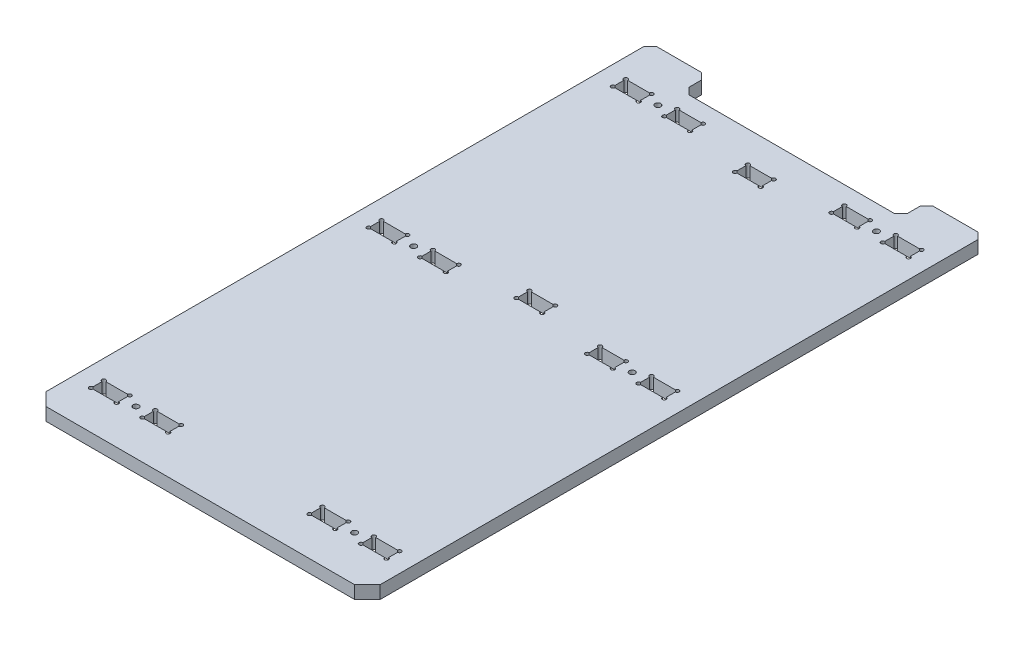
from build123d import *

# Parameters (mm, degrees)
SKETCH1_W            = 260
SKETCH1_H            = 440
EXTRUDE1_DEPTH       = 10
SKETCH3_W            = 260
SKETCH3_H            = 40
EXTRUDE3_DEPTH       = 10
SKETCH4_W            = 20
SKETCH4_H            = 10
CUT_EXTRUDE1_DEPTH   = 10
EXTRUDE4_DEPTH       = 10
MIRROR2_COPY_1_DEPTH = 10
MIRROR3_COPY_1_DEPTH = 10
MIRROR3_COPY_2_DEPTH = 10
MIRROR3_COPY_3_DEPTH = 10
MIRROR4_COPY_1_DEPTH = 10
MIRROR4_COPY_2_DEPTH = 10
MIRROR4_COPY_3_DEPTH = 10
M4_CLEARANCE_HOLE1_D = 4.5
SKETCH8_W            = 20
SKETCH8_H            = 10
CUT_EXTRUDE2_DEPTH   = 10
EXTRUDE5_DEPTH       = 10
CHAMFER1_SIZE        = 10
SKETCH10_W           = 170
SKETCH10_H           = 20
EXTRUDE6_DEPTH       = 10
CHAMFER2_SIZE        = 5


with BuildPart() as part:
    # Sketch1 → Extrude1 (new body)
    with BuildSketch(Plane(origin=(0, 0, 0), x_dir=(1, 0, 0), z_dir=(0, 1, 0))):
        Rectangle(SKETCH1_W, SKETCH1_H)
    extrude(amount=EXTRUDE1_DEPTH)

    # Sketch3 → Extrude3 (add)
    with BuildSketch(Plane(origin=(0, 10, 0), x_dir=(1, 0, 0), z_dir=(0, 1, 0))):
        with Locations((0, 240)):
            Rectangle(SKETCH3_W, SKETCH3_H)
    extrude(amount=-EXTRUDE3_DEPTH)

    # Sketch4 → Cut-Extrude1 (cut)
    with BuildSketch(Plane(origin=(130, 0, -206), x_dir=(1, 0, 0), z_dir=(0, -1, 0))):
        with Locations((-235, 391)):
            Rectangle(SKETCH4_W, SKETCH4_H)
        with Locations((-195, 391)):
            Rectangle(SKETCH4_W, SKETCH4_H)
        with Locations((-65, 391)):
            Rectangle(SKETCH4_W, SKETCH4_H)
        with Locations((-25, 391)):
            Rectangle(SKETCH4_W, SKETCH4_H)
        with Locations((-235, 175)):
            Rectangle(SKETCH4_W, SKETCH4_H)
        with Locations((-195, 175)):
            Rectangle(SKETCH4_W, SKETCH4_H)
        with Locations((-65, 175)):
            Rectangle(SKETCH4_W, SKETCH4_H)
        with Locations((-25, 175)):
            Rectangle(SKETCH4_W, SKETCH4_H)
        with Locations((-235, -15)):
            Rectangle(SKETCH4_W, SKETCH4_H)
        with Locations((-195, -15)):
            Rectangle(SKETCH4_W, SKETCH4_H)
        with Locations((-65, -15)):
            Rectangle(SKETCH4_W, SKETCH4_H)
        with Locations((-25, -15)):
            Rectangle(SKETCH4_W, SKETCH4_H)
    extrude(amount=-CUT_EXTRUDE1_DEPTH, mode=Mode.SUBTRACT)

    # Sketch5 → Extrude4 (cut)
    with BuildSketch(Plane(origin=(0, 0, 0), x_dir=(-1, 0, 0), z_dir=(0, -1, 0))):
        with BuildLine():
            Line((96.5, -190), (95, -190))
            Line((95, -190), (95, -188.5))
            ThreePointArc((95, -188.5), (93.939339828, -191.060660172), (96.5, -190))
        make_face()
        with BuildLine():
            Line((115, -190), (113.5, -190))
            ThreePointArc((113.5, -190), (116.060660172, -191.060660172), (115, -188.5))
            Line((115, -188.5), (115, -190))
        make_face()
        with BuildLine():
            Line((115, -180), (113.5, -180))
            ThreePointArc((113.5, -180), (116.060660172, -178.939339828), (115, -181.5))
            Line((115, -181.5), (115, -180))
        make_face()
        with BuildLine():
            Line((96.5, -180), (95, -180))
            Line((95, -180), (95, -181.5))
            ThreePointArc((95, -181.5), (93.939339828, -178.939339828), (96.5, -180))
        make_face()
    extrude4 = extrude(amount=-EXTRUDE4_DEPTH, mode=Mode.SUBTRACT)

    # Mirror1: Extrude4 across plane
    add(extrude4.mirror(Plane(origin=(-85, 0, 0), x_dir=(0, 0, 1), z_dir=(1, 0, 0))), mode=Mode.SUBTRACT)

    # Mirror2: Extrude4 across plane
    add(extrude4.mirror(Plane(origin=(0, 0, 0), x_dir=(0, 0, 1), z_dir=(1, 0, 0))), mode=Mode.SUBTRACT)

    # Mirror2 copy 1 sketch → Mirror2 copy 1 (cut)
    with BuildSketch(Plane(origin=(170, 0, 0), x_dir=(-1, 0, 0), z_dir=(0, -1, 0))):
        with BuildLine():
            Line((96.5, -190), (95, -190))
            Line((95, -190), (95, -188.5))
            ThreePointArc((95, -188.5), (93.939339828, -191.060660172), (96.5, -190))
        make_face()
        with BuildLine():
            Line((115, -190), (113.5, -190))
            ThreePointArc((113.5, -190), (116.060660172, -191.060660172), (115, -188.5))
            Line((115, -188.5), (115, -190))
        make_face()
        with BuildLine():
            Line((115, -180), (113.5, -180))
            ThreePointArc((113.5, -180), (116.060660172, -178.939339828), (115, -181.5))
            Line((115, -181.5), (115, -180))
        make_face()
        with BuildLine():
            Line((96.5, -180), (95, -180))
            Line((95, -180), (95, -181.5))
            ThreePointArc((95, -181.5), (93.939339828, -178.939339828), (96.5, -180))
        make_face()
    extrude(amount=-MIRROR2_COPY_1_DEPTH, mode=Mode.SUBTRACT)

    # Mirror3: Extrude4 across plane
    add(extrude4.mirror(Plane(origin=(0, 0, 77), x_dir=(1, 0, 0), z_dir=(0, 0, -1))), mode=Mode.SUBTRACT)

    # Mirror3 copy 1 sketch → Mirror3 copy 1 (cut)
    with BuildSketch(Plane(origin=(-170, 0, 154), x_dir=(1, 0, 0), z_dir=(0, -1, 0))):
        with BuildLine():
            Line((96.5, -190), (95, -190))
            Line((95, -190), (95, -188.5))
            ThreePointArc((95, -188.5), (93.939339828, -191.060660172), (96.5, -190))
        make_face()
        with BuildLine():
            Line((115, -190), (113.5, -190))
            ThreePointArc((113.5, -190), (116.060660172, -191.060660172), (115, -188.5))
            Line((115, -188.5), (115, -190))
        make_face()
        with BuildLine():
            Line((115, -180), (113.5, -180))
            ThreePointArc((113.5, -180), (116.060660172, -178.939339828), (115, -181.5))
            Line((115, -181.5), (115, -180))
        make_face()
        with BuildLine():
            Line((96.5, -180), (95, -180))
            Line((95, -180), (95, -181.5))
            ThreePointArc((95, -181.5), (93.939339828, -178.939339828), (96.5, -180))
        make_face()
    extrude(amount=-MIRROR3_COPY_1_DEPTH, mode=Mode.SUBTRACT)

    # Mirror3 copy 2 sketch → Mirror3 copy 2 (cut)
    with BuildSketch(Plane(origin=(0, 0, 154), x_dir=(1, 0, 0), z_dir=(0, -1, 0))):
        with BuildLine():
            Line((96.5, -190), (95, -190))
            Line((95, -190), (95, -188.5))
            ThreePointArc((95, -188.5), (93.939339828, -191.060660172), (96.5, -190))
        make_face()
        with BuildLine():
            Line((115, -190), (113.5, -190))
            ThreePointArc((113.5, -190), (116.060660172, -191.060660172), (115, -188.5))
            Line((115, -188.5), (115, -190))
        make_face()
        with BuildLine():
            Line((115, -180), (113.5, -180))
            ThreePointArc((113.5, -180), (116.060660172, -178.939339828), (115, -181.5))
            Line((115, -181.5), (115, -180))
        make_face()
        with BuildLine():
            Line((96.5, -180), (95, -180))
            Line((95, -180), (95, -181.5))
            ThreePointArc((95, -181.5), (93.939339828, -178.939339828), (96.5, -180))
        make_face()
    extrude(amount=-MIRROR3_COPY_2_DEPTH, mode=Mode.SUBTRACT)

    # Mirror3 copy 3 sketch → Mirror3 copy 3 (cut)
    with BuildSketch(Plane(origin=(170, 0, 154), x_dir=(-1, 0, 0), z_dir=(0, -1, 0))):
        with BuildLine():
            Line((96.5, 190), (95, 190))
            Line((95, 190), (95, 188.5))
            ThreePointArc((95, 188.5), (93.939339828, 191.060660172), (96.5, 190))
        make_face()
        with BuildLine():
            Line((115, 190), (113.5, 190))
            ThreePointArc((113.5, 190), (116.060660172, 191.060660172), (115, 188.5))
            Line((115, 188.5), (115, 190))
        make_face()
        with BuildLine():
            Line((115, 180), (113.5, 180))
            ThreePointArc((113.5, 180), (116.060660172, 178.939339828), (115, 181.5))
            Line((115, 181.5), (115, 180))
        make_face()
        with BuildLine():
            Line((96.5, 180), (95, 180))
            Line((95, 180), (95, 181.5))
            ThreePointArc((95, 181.5), (93.939339828, 178.939339828), (96.5, 180))
        make_face()
    extrude(amount=-MIRROR3_COPY_3_DEPTH, mode=Mode.SUBTRACT)

    # Mirror4: Extrude4 across plane
    add(extrude4.mirror(Plane.XY.offset(-18)), mode=Mode.SUBTRACT)

    # Mirror4 copy 1 sketch → Mirror4 copy 1 (cut)
    with BuildSketch(Plane(origin=(-170, 0, -36), x_dir=(1, 0, 0), z_dir=(0, -1, 0))):
        with BuildLine():
            Line((96.5, -190), (95, -190))
            Line((95, -190), (95, -188.5))
            ThreePointArc((95, -188.5), (93.939339828, -191.060660172), (96.5, -190))
        make_face()
        with BuildLine():
            Line((115, -190), (113.5, -190))
            ThreePointArc((113.5, -190), (116.060660172, -191.060660172), (115, -188.5))
            Line((115, -188.5), (115, -190))
        make_face()
        with BuildLine():
            Line((115, -180), (113.5, -180))
            ThreePointArc((113.5, -180), (116.060660172, -178.939339828), (115, -181.5))
            Line((115, -181.5), (115, -180))
        make_face()
        with BuildLine():
            Line((96.5, -180), (95, -180))
            Line((95, -180), (95, -181.5))
            ThreePointArc((95, -181.5), (93.939339828, -178.939339828), (96.5, -180))
        make_face()
    extrude(amount=-MIRROR4_COPY_1_DEPTH, mode=Mode.SUBTRACT)

    # Mirror4 copy 2 sketch → Mirror4 copy 2 (cut)
    with BuildSketch(Plane(origin=(0, 0, -36), x_dir=(1, 0, 0), z_dir=(0, -1, 0))):
        with BuildLine():
            Line((96.5, -190), (95, -190))
            Line((95, -190), (95, -188.5))
            ThreePointArc((95, -188.5), (93.939339828, -191.060660172), (96.5, -190))
        make_face()
        with BuildLine():
            Line((115, -190), (113.5, -190))
            ThreePointArc((113.5, -190), (116.060660172, -191.060660172), (115, -188.5))
            Line((115, -188.5), (115, -190))
        make_face()
        with BuildLine():
            Line((115, -180), (113.5, -180))
            ThreePointArc((113.5, -180), (116.060660172, -178.939339828), (115, -181.5))
            Line((115, -181.5), (115, -180))
        make_face()
        with BuildLine():
            Line((96.5, -180), (95, -180))
            Line((95, -180), (95, -181.5))
            ThreePointArc((95, -181.5), (93.939339828, -178.939339828), (96.5, -180))
        make_face()
    extrude(amount=-MIRROR4_COPY_2_DEPTH, mode=Mode.SUBTRACT)

    # Mirror4 copy 3 sketch → Mirror4 copy 3 (cut)
    with BuildSketch(Plane(origin=(170, 0, -36), x_dir=(-1, 0, 0), z_dir=(0, -1, 0))):
        with BuildLine():
            Line((96.5, 190), (95, 190))
            Line((95, 190), (95, 188.5))
            ThreePointArc((95, 188.5), (93.939339828, 191.060660172), (96.5, 190))
        make_face()
        with BuildLine():
            Line((115, 190), (113.5, 190))
            ThreePointArc((113.5, 190), (116.060660172, 191.060660172), (115, 188.5))
            Line((115, 188.5), (115, 190))
        make_face()
        with BuildLine():
            Line((115, 180), (113.5, 180))
            ThreePointArc((113.5, 180), (116.060660172, 178.939339828), (115, 181.5))
            Line((115, 181.5), (115, 180))
        make_face()
        with BuildLine():
            Line((96.5, 180), (95, 180))
            Line((95, 180), (95, 181.5))
            ThreePointArc((95, 181.5), (93.939339828, 178.939339828), (96.5, 180))
        make_face()
    extrude(amount=-MIRROR4_COPY_3_DEPTH, mode=Mode.SUBTRACT)

    # M4 Clearance Hole1 (through all)
    with Locations(Plane(origin=(0, 10, 0), x_dir=(1, 0, 0), z_dir=(0, 1, 0))):
        with Locations((-85, 221), (85, 221), (85, 31), (-85, 31), (-85, -185), (85, -185)):
            Hole(M4_CLEARANCE_HOLE1_D / 2)

    # Sketch8 → Cut-Extrude2 (cut)
    with BuildSketch(Plane(origin=(130, 0, -206), x_dir=(1, 0, 0), z_dir=(0, -1, 0))):
        with Locations((-130, 165)):
            Rectangle(SKETCH8_W, SKETCH8_H)
        with Locations((-130, -5)):
            Rectangle(SKETCH8_W, SKETCH8_H)
    extrude(amount=-CUT_EXTRUDE2_DEPTH, mode=Mode.SUBTRACT)

    # Sketch9 → Extrude5 (cut)
    with BuildSketch(Plane.XZ):
        with BuildLine():
            Line((-10, -44.5), (-10, -46))
            Line((-10, -46), (-8.5, -46))
            ThreePointArc((-8.5, -46), (-11.060660172, -47.060660172), (-10, -44.5))
        make_face()
        with BuildLine():
            Line((-10, -36), (-8.5, -36))
            ThreePointArc((-8.5, -36), (-11.060660172, -34.939339828), (-10, -37.5))
            Line((-10, -37.5), (-10, -36))
        make_face()
        with BuildLine():
            Line((10, -36), (10, -37.5))
            ThreePointArc((10, -37.5), (11.060660172, -34.939339828), (8.5, -36))
            Line((8.5, -36), (10, -36))
        make_face()
        with BuildLine():
            Line((8.5, -46), (10, -46))
            Line((10, -46), (10, -44.5))
            ThreePointArc((10, -44.5), (11.060660172, -47.060660172), (8.5, -46))
        make_face()
    extrude5 = extrude(amount=-EXTRUDE5_DEPTH, mode=Mode.SUBTRACT)

    # Mirror5: Extrude5 across plane
    add(extrude5.mirror(Plane.XY.offset(-126)), mode=Mode.SUBTRACT)

    # Chamfer1
    chamfer1_edges = [part.edges().sort_by_distance(p)[0] for p in [
        (130, 5, 220),
        (-130, 5, 220),
    ]]
    chamfer(chamfer1_edges, length=CHAMFER1_SIZE)

    # Sketch10 → Extrude6 (cut)
    with BuildSketch(Plane(origin=(0, 10, 0), x_dir=(1, 0, 0), z_dir=(0, 1, 0))):
        with Locations((0, 250)):
            Rectangle(SKETCH10_W, SKETCH10_H)
    extrude(amount=-EXTRUDE6_DEPTH, mode=Mode.SUBTRACT)

    # Chamfer2
    chamfer2_edges = [part.edges().sort_by_distance(p)[0] for p in [
        (-130, 5, -260),
        (130, 5, -260),
        (-85, 5, -240),
        (-85, 5, -260),
        (85, 5, -260),
        (85, 5, -240),
    ]]
    chamfer(chamfer2_edges, length=CHAMFER2_SIZE)


solid = part.part
